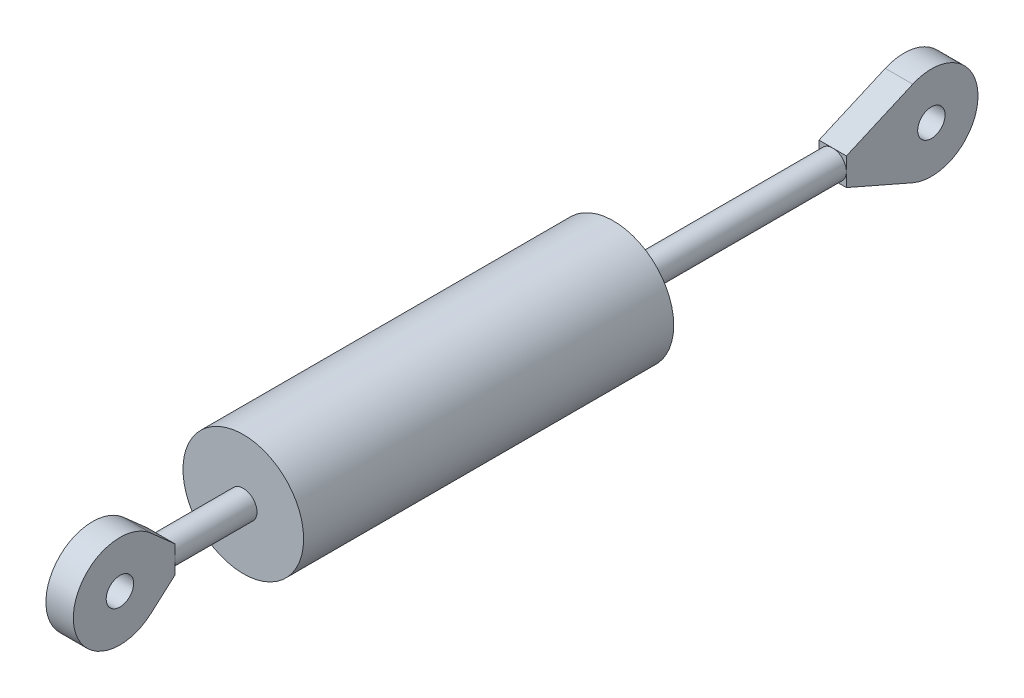
from build123d import *

# Parameters (mm, degrees)
SKETCH1_W                = 67.5
SKETCH1_H                = 11
SKETCH2_R                = 2.5
BOSS_EXTRUDE1_DEPTH      = 15
BOSS_EXTRUDE2_DEPTH      = 2.5
BOSS_EXTRUDE2_DEPTH_BACK = 2.5
SKETCH3_R                = 2.5
BOSS_EXTRUDE3_START      = 40
SKETCH4_R                = 2.5
BOSS_EXTRUDE3_DEPTH      = 40
BOSS_EXTRUDE4_DEPTH      = 2.5
BOSS_EXTRUDE4_DEPTH_BACK = 2.5
SKETCH5_R                = 2.5


with BuildPart() as part:
    # Sketch1 → Revolve1 (revolve)
    with BuildSketch(Plane(origin=(0, 0, 0), x_dir=(0, 0, -1), z_dir=(1, 0, 0)), mode=Mode.PRIVATE) as revolve1_sk:
        with Locations((-0.842105263, 5.5)):
            Rectangle(SKETCH1_W, SKETCH1_H)
    revolve(revolve1_sk.sketch.rotate(Axis((0, 0, 34.592105263), (0, 0, -1)), 90), axis=Axis((0, 0, 34.592105263), (0, 0, -1)))

    # Sketch2 → Boss-Extrude1 (add)
    with BuildSketch(Plane.XY.offset(34.592105263)):
        Circle(SKETCH2_R)
    extrude(amount=BOSS_EXTRUDE1_DEPTH)

    # Sketch3 → Boss-Extrude2 (add, two sides: drawn at the far end of the back side and taken through both)
    with BuildSketch(Plane(origin=(0, 0, 0), x_dir=(0, 0, -1), z_dir=(1, 0, 0)).offset(-BOSS_EXTRUDE2_DEPTH_BACK)):
        with BuildLine():
            Line((-49.592105263, 2.5), (-53.958295642, 6.364761516))
            ThreePointArc((-53.958295642, 6.364761516), (-68.092105263, 0), (-53.958295642, -6.364761516))
            Line((-53.958295642, -6.364761516), (-49.592105263, -2.5))
            Line((-49.592105263, -2.5), (-49.592105263, 2.5))
        make_face()
        with Locations((-59.592105263, 0)):
            Circle(SKETCH3_R, mode=Mode.SUBTRACT)
    extrude(amount=BOSS_EXTRUDE2_DEPTH + BOSS_EXTRUDE2_DEPTH_BACK)

    # Sketch4 → Boss-Extrude3 (add)
    with BuildSketch(Plane(origin=(0, 0, -32.907894737), x_dir=(-1, 0, 0), z_dir=(0, 0, -1)).offset(BOSS_EXTRUDE3_START)):
        with Locations(Location((0, 0, 0), (0, 0, 180))):
            Circle(SKETCH4_R)
    extrude(amount=-BOSS_EXTRUDE3_DEPTH)

    # Sketch5 → Boss-Extrude4 (add, two sides: drawn at the far end of the back side and taken through both)
    with BuildSketch(Plane(origin=(0, 0, 0), x_dir=(0, 0, -1), z_dir=(1, 0, 0)).offset(-BOSS_EXTRUDE4_DEPTH_BACK)):
        with BuildLine():
            Line((72.907894737, 2.5), (85.002754977, 7.788133487))
            ThreePointArc((85.002754977, 7.788133487), (96.907894737, 0), (85.002754977, -7.788133487))
            Line((85.002754977, -7.788133487), (72.907894737, -2.5))
            Line((72.907894737, -2.5), (72.907894737, 2.5))
        make_face()
        with Locations((88.407894737, 0)):
            Circle(SKETCH5_R, mode=Mode.SUBTRACT)
    extrude(amount=BOSS_EXTRUDE4_DEPTH + BOSS_EXTRUDE4_DEPTH_BACK)


solid = part.part
